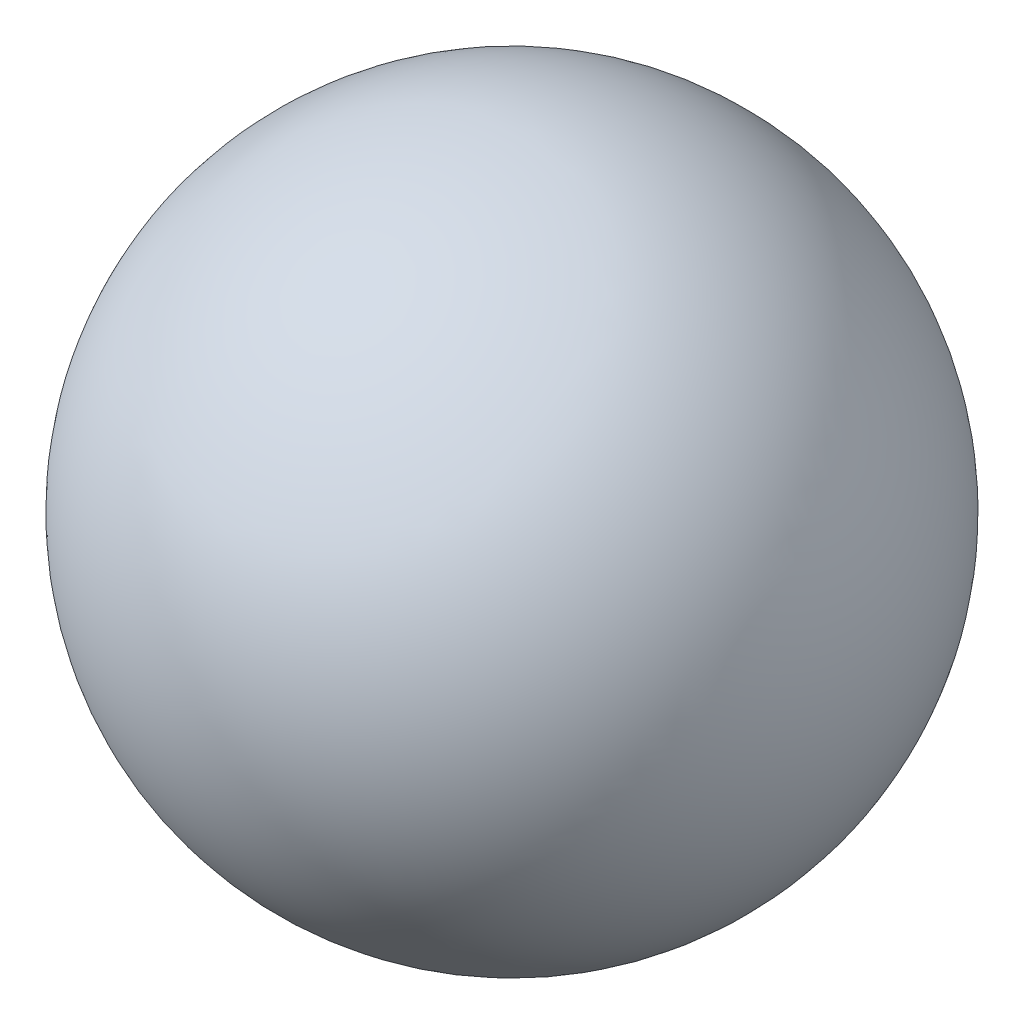
from build123d import *


with BuildPart() as part:
    # Esquisse1 → Révolution1 (revolve)
    with BuildSketch(Plane.XY):
        with BuildLine():
            Line((-4, 0), (4, 0))
            ThreePointArc((4, 0), (0, 4), (-4, 0))
        make_face()
    revolve(axis=Axis((-42.081762295, 0, 0), (1, 0, 0)))


solid = part.part
